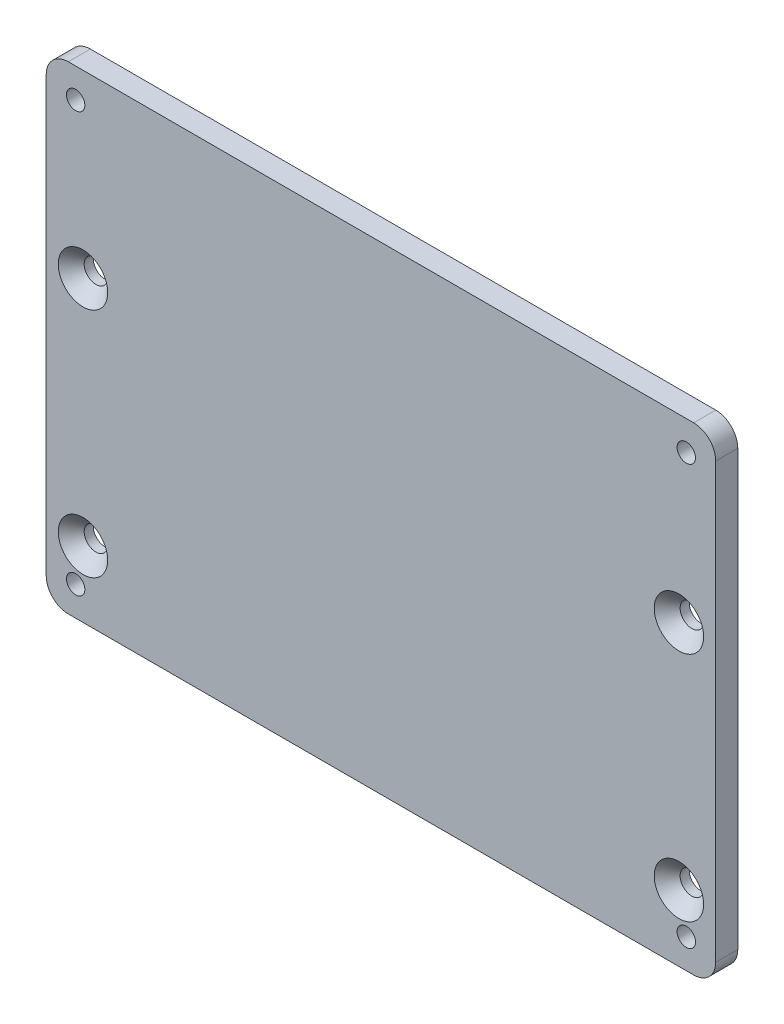
from build123d import *

# Parameters (mm, degrees)
SKETCH1_W                    = 91
SKETCH1_H                    = 65
BOSS_EXTRUDE1_DEPTH          = 3
TAP_DRILL_FOR_M3X0_5_TAP1_D  = 2.5
FILLET1_R                    = 3
CSK_FOR_M3_SFHCS1_AT_2_COUNT = 2
CSK_FOR_M3_SFHCS1_AT_2_PITCH = 31.5
CSK_FOR_M3_SFHCS1_AT_3_COUNT = 2
CSK_FOR_M3_SFHCS1_AT_3_PITCH = 86.909435621
CSK_FOR_M3_SFHCS1_AT_4_COUNT = 2
CSK_FOR_M3_SFHCS1_AT_4_PITCH = 81


with BuildPart() as part:
    # Sketch1 → Boss-Extrude1 (new body)
    with BuildSketch(Plane.XY):
        Rectangle(SKETCH1_W, SKETCH1_H)
    extrude(amount=BOSS_EXTRUDE1_DEPTH)

    # Tap Drill for M3x0.5 Tap1 (through all)
    with Locations(Plane.XY.offset(3)):
        with Locations((-41.5, 28.5), (41.5, 28.5), (41.5, -28.5), (-41.5, -28.5)):
            Hole(TAP_DRILL_FOR_M3X0_5_TAP1_D / 2)

    # Fillet1
    fillet1_edges = [part.edges().sort_by_distance(p)[0] for p in [
        (-45.5, 32.5, 1.5),
        (45.5, 32.5, 1.5),
        (45.5, -32.5, 1.5),
        (-45.5, -32.5, 1.5),
    ]]
    fillet(fillet1_edges, radius=FILLET1_R)

    # Sketch7 → CSK for M3 SFHCS1 (revolve, cut)
    with BuildSketch(Plane(origin=(-40.5, 8, 3), x_dir=(0, -1, 0), z_dir=(1, 0, 0))):
        Polygon((0, 0), (0, 3), (1.6, 3), (1.6, 1.76), (3.36, 0), align=None)
    csk_for_m3_sfhcs1 = revolve(axis=Axis((-40.5, 8, 9.35), (0, 0, -1)), mode=Mode.SUBTRACT)

    # CSK for M3 SFHCS1 at 2: CSK for M3 SFHCS1 ×2
    with Locations(*[(0, -i * CSK_FOR_M3_SFHCS1_AT_2_PITCH, 0) for i in range(1, CSK_FOR_M3_SFHCS1_AT_2_COUNT)]):
        add(csk_for_m3_sfhcs1, mode=Mode.SUBTRACT)

    # CSK for M3 SFHCS1 at 3: CSK for M3 SFHCS1 ×2
    with Locations(*[Vector(0.932004671541296, -0.36244626115494855, 0) * (i * CSK_FOR_M3_SFHCS1_AT_3_PITCH) for i in range(1, CSK_FOR_M3_SFHCS1_AT_3_COUNT)]):
        add(csk_for_m3_sfhcs1, mode=Mode.SUBTRACT)

    # CSK for M3 SFHCS1 at 4: CSK for M3 SFHCS1 ×2
    with Locations(*[(i * CSK_FOR_M3_SFHCS1_AT_4_PITCH, 0, 0) for i in range(1, CSK_FOR_M3_SFHCS1_AT_4_COUNT)]):
        add(csk_for_m3_sfhcs1, mode=Mode.SUBTRACT)


solid = part.part
